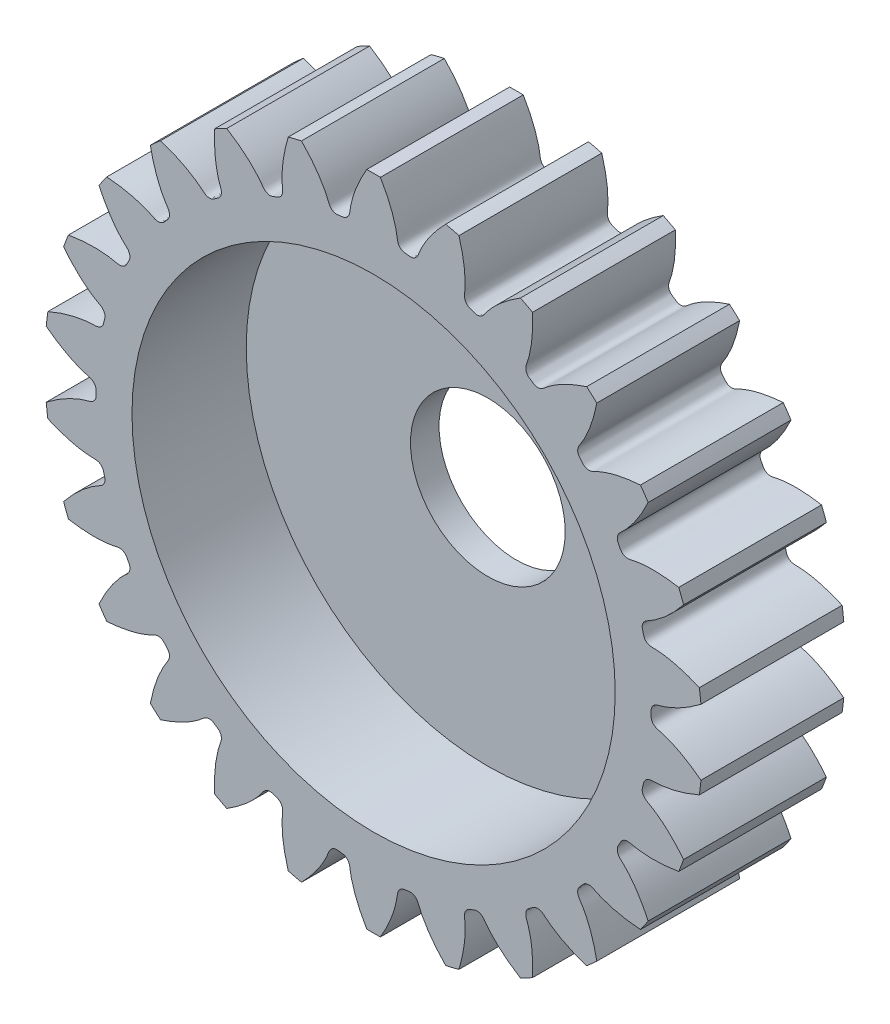
from build123d import *

# Parameters (mm, degrees)
SKETCHREVOLVESPURASSEMBLYNEW2PINION_W       = 6
SKETCHREVOLVESPURASSEMBLYNEW2PINION_H       = 13.822115385
TOOTHEXTRUDECUTSPURASSEMBLYNEW2PINION_DEPTH = 4
PATTERNSPURASSEMBLYNEW2PINION_COUNT         = 26
SKETCH_2_R                                  = 10.15
CUT_EXTRUDE_2_DEPTH                         = 4.8
SKETCH_4_R                                  = 3.25
CUT_EXTRUDE_3_DEPTH                         = 21.080697223


with BuildPart() as part:
    # SketchRevolveSpurAssemblyNew2Pinion → SpurAssemblyNew2Pinion (revolve)
    with BuildSketch(Plane(origin=(0, 0, 0), x_dir=(0, 0, -1), z_dir=(1, 0, 0))):
        with Locations((-1, 6.911057693)):
            Rectangle(SKETCHREVOLVESPURASSEMBLYNEW2PINION_W, SKETCHREVOLVESPURASSEMBLYNEW2PINION_H)
    revolve(axis=Axis((0, 0, 0), (0, 0, -1)))

    # SketchToothSpurAssemblyNew2Pinion → ToothExtrudeCutSpurAssemblyNew2Pinion (cut, symmetric)
    with BuildSketch(Plane.XY):
        with BuildLine():
            ThreePointArc((13.81451757, 1.428912571), (13.888221154, 0), (13.81451757, -1.428912571))
            add(Edge.make_bspline(
                [(13.81451757, -1.428912571), (13.726688541, -1.359920515), (13.595197672, -1.261341012), (13.418856258, -1.138772461), (13.292585484, -1.055332348), (13.169877801, -0.978321954), (13.050962499, -0.907526114), (12.936060688, -0.842722426), (12.825385077, -0.783681639), (12.719139799, -0.730167838), (12.617520148, -0.681938938), (12.520712627, -0.638746252), (12.428893992, -0.600337203), (12.342233738, -0.566447419), (12.260885006, -0.536828638), (12.185014321, -0.511156667), (12.114702314, -0.489338003), (12.027112004, -0.463735243), (11.954138744, -0.448230597), (11.897794168, -0.427981043), (11.875856753, -0.418994985), (11.853410983, -0.408473503), (11.830202837, -0.395946023), (11.805975271, -0.380738879), (11.780539315, -0.361904625), (11.753919073, -0.33815527), (11.726633215, -0.307873546), (11.700089703, -0.269352659), (11.677071777, -0.221496801), (11.661562379, -0.16645758), (11.656168867, -0.09130535), (11.660269272, 0), (11.656168867, 0.09130535), (11.661562379, 0.16645758), (11.677071777, 0.221496801), (11.700089703, 0.269352659), (11.726633215, 0.307873546), (11.753919073, 0.33815527), (11.780539315, 0.361904625), (11.805975271, 0.380738879), (11.830202837, 0.395946023), (11.853410983, 0.408473503), (11.875856753, 0.418994985), (11.897794168, 0.427981043), (11.954138744, 0.448230597), (12.027112004, 0.463735243), (12.114702314, 0.489338003), (12.185014321, 0.511156667), (12.260885006, 0.536828638), (12.342233738, 0.566447419), (12.428893992, 0.600337203), (12.520712627, 0.638746252), (12.617520148, 0.681938938), (12.719139799, 0.730167838), (12.825385077, 0.783681639), (12.936060688, 0.842722426), (13.050962499, 0.907526114), (13.169877801, 0.978321954), (13.292585484, 1.055332348), (13.418856258, 1.138772461), (13.595197672, 1.261341012), (13.726688541, 1.359920515), (13.81451757, 1.428912571)],
                knots=[0, 0, 0, 0, 0.061765594, 0.090857399, 0.118755208, 0.145459022, 0.170968841, 0.195284665, 0.218406493, 0.240334327, 0.261068165, 0.280608009, 0.298953857, 0.31610571, 0.332063567, 0.34682743, 0.360397297, 0.37277317, 0.397298679, 0.401522405, 0.405867911, 0.410405301, 0.415225201, 0.420444455, 0.426211586, 0.432708636, 0.440141309, 0.448702283, 0.458489871, 0.469387514, 0.480099546, 0.5, 0.519900454, 0.530612486, 0.541510129, 0.551297717, 0.559858691, 0.567291364, 0.573788414, 0.579555545, 0.584774799, 0.589594699, 0.594132089, 0.598477595, 0.602701321, 0.62722683, 0.639602703, 0.65317257, 0.667936433, 0.68389429, 0.701046143, 0.719391991, 0.738931835, 0.759665673, 0.781593507, 0.804715335, 0.829031159, 0.854540978, 0.881244792, 0.909142601, 0.938234406, 1, 1, 1, 1], degree=3))
        make_face()
    toothextrudecutspurassemblynew2pinion = extrude(amount=TOOTHEXTRUDECUTSPURASSEMBLYNEW2PINION_DEPTH, both=True, mode=Mode.SUBTRACT)

    # PatternSpurAssemblyNew2Pinion: ToothExtrudeCutSpurAssemblyNew2Pinion ×26 about axis
    patternspurassemblynew2pinion_axis = Axis((0, 0, 50), (0, 0, -1))
    for i in range(1, PATTERNSPURASSEMBLYNEW2PINION_COUNT):
        add(toothextrudecutspurassemblynew2pinion.rotate(patternspurassemblynew2pinion_axis, i * 360 / PATTERNSPURASSEMBLYNEW2PINION_COUNT), mode=Mode.SUBTRACT)

    # Эскиз2 → Вырез-Вытянуть2 (cut)
    with BuildSketch(Plane.XY.offset(4)):
        Circle(SKETCH_2_R)
    extrude(amount=-CUT_EXTRUDE_2_DEPTH, mode=Mode.SUBTRACT)

    # Эскиз4 → Вырез-Вытянуть3 (cut, through all)
    with BuildSketch(Plane.XY.offset(-0.8)):
        Circle(SKETCH_4_R)
    extrude(amount=-CUT_EXTRUDE_3_DEPTH, mode=Mode.SUBTRACT)


solid = part.part
